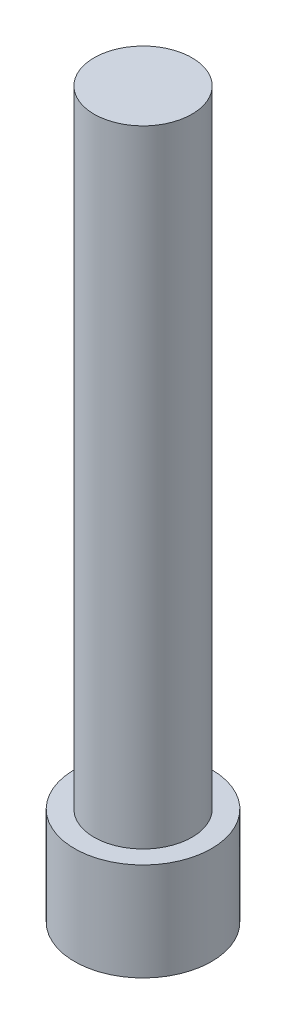
from build123d import *

# Parameters (mm, degrees)
SKETCH_1_R      = 2.5
EXTRUDE_1_DEPTH = 32
SKETCH_2_R      = 3.5
EXTRUDE_2_DEPTH = 5


with BuildPart() as part:
    # 草图1 → 凸台-拉伸1 (new body)
    with BuildSketch(Plane(origin=(0, 0, 0), x_dir=(1, 0, 0), z_dir=(0, 1, 0))):
        with Locations(Location((0, 0, 0), (0, 0, 270))):
            Circle(SKETCH_1_R)
    extrude(amount=EXTRUDE_1_DEPTH)

    # 草图2 → 凸台-拉伸2 (add)
    with BuildSketch(Plane.XZ):
        with Locations(Location((0, 0, 0), (0, 0, 270))):
            Circle(SKETCH_2_R)
    extrude(amount=EXTRUDE_2_DEPTH)


solid = part.part
